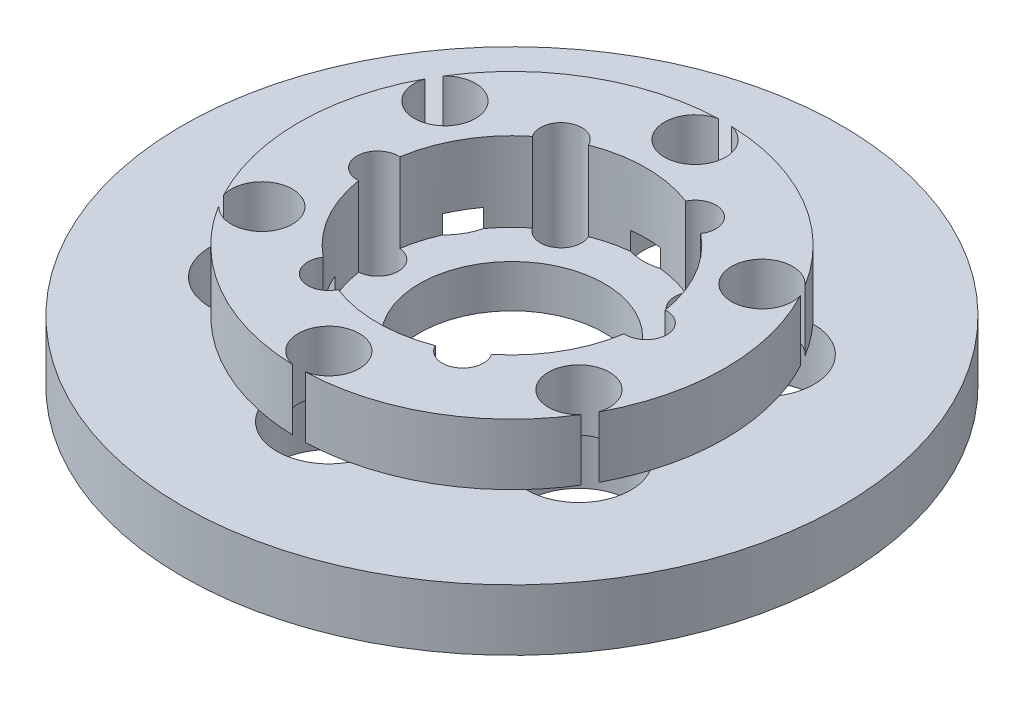
from build123d import *

# Parameters (mm, degrees)
SKETCH1_R           = 27
BOSS_EXTRUDE1_DEPTH = 5
SKETCH2_R           = 17.45
BOSS_EXTRUDE2_DEPTH = 5
SKETCH3_R           = 2.5
CUT_EXTRUDE1_DEPTH  = 15
SKETCH5_R           = 11
CUT_EXTRUDE2_DEPTH  = 6.5
SKETCH6_R           = 1.689113582
CUT_EXTRUDE3_DEPTH  = 36.5
SKETCH7_R           = 5
CUT_EXTRUDE4_DEPTH  = 36.5
SKETCH8_R           = 4.25
CUT_EXTRUDE5_DEPTH  = 5
CUT_EXTRUDE6_REACH  = 40.733
SKETCH10_R          = 7.574183751


with BuildPart() as part:
    # Sketch1 → Boss-Extrude1 (new body)
    with BuildSketch(Plane(origin=(0, 0, 0), x_dir=(1, 0, 0), z_dir=(0, 1, 0))):
        with Locations(Location((0, 0, 0), (0, 0, 270))):
            Circle(SKETCH1_R)
    extrude(amount=BOSS_EXTRUDE1_DEPTH)

    # Sketch2 → Boss-Extrude2 (add)
    with BuildSketch(Plane(origin=(0, 5, 0), x_dir=(1, 0, 0), z_dir=(0, 1, 0))):
        with Locations(Location((0, 0, 0), (0, 0, 270))):
            Circle(SKETCH2_R)
    extrude(amount=BOSS_EXTRUDE2_DEPTH)

    # Sketch3 → Cut-Extrude1 (cut)
    with BuildSketch(Plane.XZ):
        with Locations(Location((0, 15, 0), (0, 0, 270))):
            Circle(SKETCH3_R)
        with Locations(Location((12.990381057, 7.5, 0), (0, 0, 270))):
            Circle(SKETCH3_R)
        with Locations(Location((12.990381057, -7.5, 0), (0, 0, 270))):
            Circle(SKETCH3_R)
        with Locations(Location((0, -15, 0), (0, 0, 270))):
            Circle(SKETCH3_R)
        with Locations(Location((-12.990381057, -7.5, 0), (0, 0, 270))):
            Circle(SKETCH3_R)
        with Locations(Location((-12.990381057, 7.5, 0), (0, 0, 270))):
            Circle(SKETCH3_R)
    extrude(amount=-CUT_EXTRUDE1_DEPTH, mode=Mode.SUBTRACT)

    # Sketch5 → Cut-Extrude2 (cut)
    with BuildSketch(Plane(origin=(0, 10, 0), x_dir=(1, 0, 0), z_dir=(0, 1, 0))):
        with Locations(Location((0, 0, 0), (0, 0, 270))):
            Circle(SKETCH5_R)
    extrude(amount=-CUT_EXTRUDE2_DEPTH, mode=Mode.SUBTRACT)

    # Sketch6 → Cut-Extrude3 (cut)
    with BuildSketch(Plane(origin=(0, 10, 0), x_dir=(1, 0, 0), z_dir=(0, 1, 0))):
        with Locations(Location((-11, 0, 0), (0, 0, 270))):
            Circle(SKETCH6_R)
        with Locations(Location((-5.5, 9.526279442, 0), (0, 0, 270))):
            Circle(SKETCH6_R)
        with Locations(Location((5.5, 9.526279442, 0), (0, 0, 270))):
            Circle(SKETCH6_R)
        with Locations(Location((11, 0, 0), (0, 0, 270))):
            Circle(SKETCH6_R)
        with Locations(Location((5.5, -9.526279442, 0), (0, 0, 270))):
            Circle(SKETCH6_R)
        with Locations(Location((-5.5, -9.526279442, 0), (0, 0, 270))):
            Circle(SKETCH6_R)
    extrude(amount=-CUT_EXTRUDE3_DEPTH, mode=Mode.SUBTRACT)

    # Sketch7 → Cut-Extrude4 (cut)
    with BuildSketch(Plane(origin=(0, 3.5, 0), x_dir=(1, 0, 0), z_dir=(0, 1, 0))):
        with Locations(Location((0, 0, 0), (0, 0, 270))):
            Circle(SKETCH7_R)
    extrude(amount=-CUT_EXTRUDE4_DEPTH, mode=Mode.SUBTRACT)

    # Sketch8 → Cut-Extrude5 (cut)
    with BuildSketch(Plane.XZ):
        with Locations(Location((0, 15, 0), (0, 0, 270))):
            Circle(SKETCH8_R)
        with Locations(Location((12.990381057, 7.5, 0), (0, 0, 270))):
            Circle(SKETCH8_R)
        with Locations(Location((12.990381057, -7.5, 0), (0, 0, 270))):
            Circle(SKETCH8_R)
        with Locations(Location((0, -15, 0), (0, 0, 270))):
            Circle(SKETCH8_R)
        with Locations(Location((-12.990381057, -7.5, 0), (0, 0, 270))):
            Circle(SKETCH8_R)
        with Locations(Location((-12.990381057, 7.5, 0), (0, 0, 270))):
            Circle(SKETCH8_R)
    extrude(amount=-CUT_EXTRUDE5_DEPTH, mode=Mode.SUBTRACT)

    # Sketch10 → Cut-Extrude6 (cut, up to next)
    with BuildSketch(Plane(origin=(0, 3.5, 0), x_dir=(1, 0, 0), z_dir=(0, 1, 0)), mode=Mode.PRIVATE) as cut_extrude6_sk1:
        with Locations(Location((0, 0, 0), (0, 0, 270))):
            Circle(SKETCH10_R)
    cut_extrude6_tool1 = extrude(cut_extrude6_sk1.sketch, amount=-CUT_EXTRUDE6_REACH, mode=Mode.PRIVATE) & part.part
    add(cut_extrude6_tool1.solids().sort_by_distance((0, 3.5, 0))[0], mode=Mode.SUBTRACT)


solid = part.part
